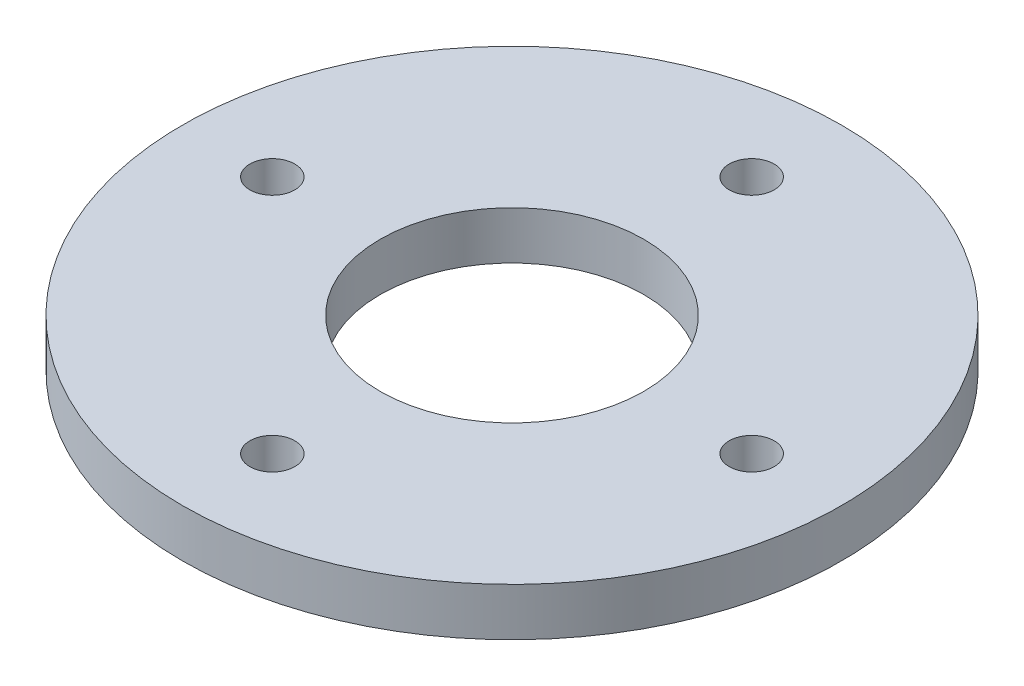
from build123d import *

# Parameters (mm, degrees)
SKETCH1_R           = 27.5
SKETCH1_R_2         = 2.5
BOSS_EXTRUDE1_DEPTH = 4
SKETCH2_R           = 11
CUT_EXTRUDE1_DEPTH  = 15
BOSS_EXTRUDE3_START = -4
SKETCH3_R           = 2.5
SKETCH3_R_2         = 1.875
BOSS_EXTRUDE3_DEPTH = 4


with BuildPart() as part:
    # Sketch1 → Boss-Extrude1 (new body)
    with BuildSketch(Plane(origin=(0, 0, 0), x_dir=(1, 0, 0), z_dir=(0, 1, 0))):
        with Locations(Location((0, 0, 0), (0, 0, 270))):
            Circle(SKETCH1_R)
        with Locations(Location((0, 20, 0), (0, 0, 270))):
            Circle(SKETCH1_R_2, mode=Mode.SUBTRACT)
        with Locations(Location((-20, 0, 0), (0, 0, 270))):
            Circle(SKETCH1_R_2, mode=Mode.SUBTRACT)
        with Locations(Location((20, 0, 0), (0, 0, 270))):
            Circle(SKETCH1_R_2, mode=Mode.SUBTRACT)
        with Locations(Location((0, -20, 0), (0, 0, 270))):
            Circle(SKETCH1_R_2, mode=Mode.SUBTRACT)
    extrude(amount=BOSS_EXTRUDE1_DEPTH)

    # Sketch2 → Cut-Extrude1 (cut)
    with BuildSketch(Plane(origin=(0, 4, 0), x_dir=(1, 0, 0), z_dir=(0, 1, 0))):
        with Locations(Location((0, 0, 0), (0, 0, 270))):
            Circle(SKETCH2_R)
    extrude(amount=-CUT_EXTRUDE1_DEPTH, mode=Mode.SUBTRACT)

    # Sketch3 → Boss-Extrude3 (add)
    # profile 1 of 4: a face of its own
    with BuildSketch(Plane(origin=(0, 4, 0), x_dir=(1, 0, 0), z_dir=(0, 1, 0)).offset(BOSS_EXTRUDE3_START)):
        with Locations((0, -20)):
            Circle(SKETCH3_R)
        with Locations(Location((0, -20, 0), (0, 0, 270))):
            Circle(SKETCH3_R_2, mode=Mode.SUBTRACT)
    # profile 2 of 4: a face of its own
    with BuildSketch(Plane(origin=(0, 4, 0), x_dir=(1, 0, 0), z_dir=(0, 1, 0)).offset(BOSS_EXTRUDE3_START)):
        with Locations((20, 0)):
            Circle(SKETCH3_R)
        with Locations(Location((20, 0, 0), (0, 0, 270))):
            Circle(SKETCH3_R_2, mode=Mode.SUBTRACT)
    # profile 3 of 4: a face of its own
    with BuildSketch(Plane(origin=(0, 4, 0), x_dir=(1, 0, 0), z_dir=(0, 1, 0)).offset(BOSS_EXTRUDE3_START)):
        with Locations((0, 20)):
            Circle(SKETCH3_R)
        with Locations(Location((0, 20, 0), (0, 0, 270))):
            Circle(SKETCH3_R_2, mode=Mode.SUBTRACT)
    # profile 4 of 4: a face of its own
    with BuildSketch(Plane(origin=(0, 4, 0), x_dir=(1, 0, 0), z_dir=(0, 1, 0)).offset(BOSS_EXTRUDE3_START)):
        with Locations((-20, 0)):
            Circle(SKETCH3_R)
        with Locations(Location((-20, 0, 0), (0, 0, 270))):
            Circle(SKETCH3_R_2, mode=Mode.SUBTRACT)
    extrude(amount=BOSS_EXTRUDE3_DEPTH)


solid = part.part
